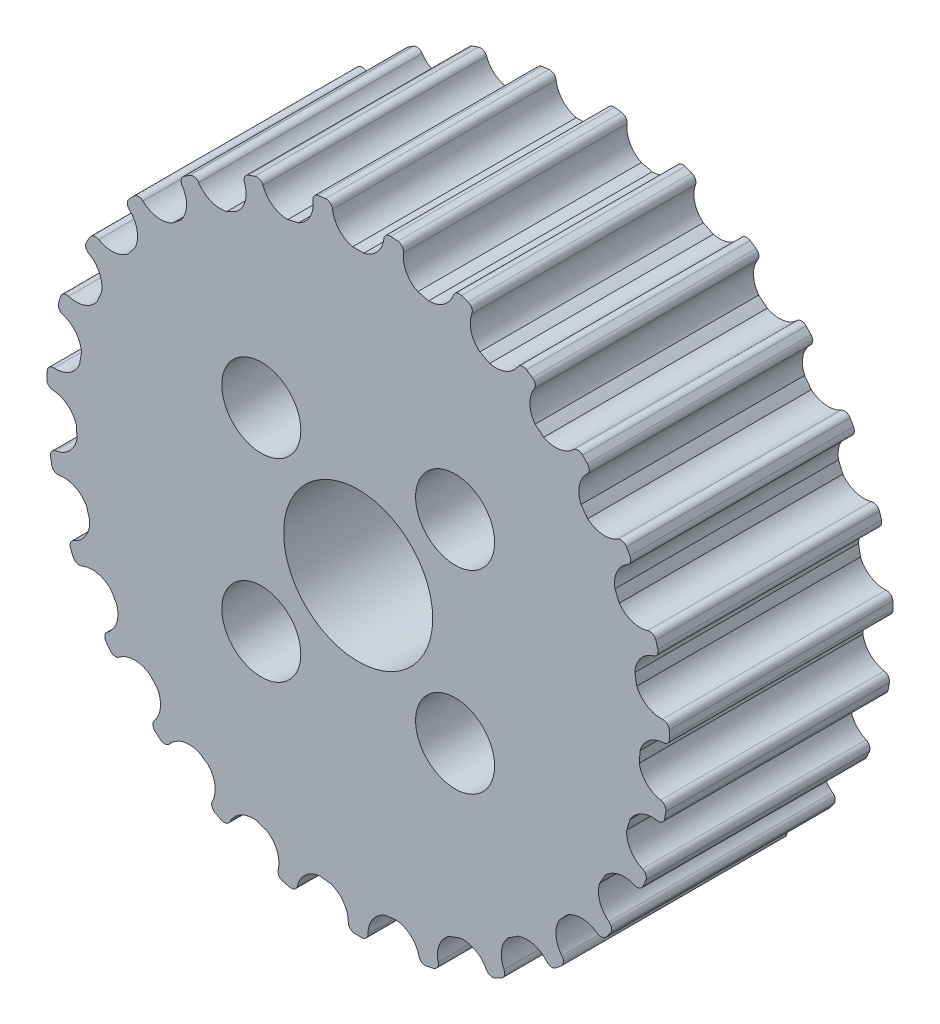
from build123d import *

# Parameters (mm, degrees)
BOSS_EXTRUDE1_DEPTH = 15
SKETCH2_R           = 2.65
SKETCH2_R_2         = 5
CUT_EXTRUDE1_DEPTH  = 34.149111671


with BuildPart() as part:
    # Sketch1 → Boss-Extrude1 (new body)
    with BuildSketch(Plane.XY.offset(7.5)):
        with BuildLine():
            ThreePointArc((-2.192674884, 20.798892855), (-2.427984889, 20.772738301), (-2.662983737, 20.743921634))
            ThreePointArc((-2.662983737, 20.743921634), (-2.947506786, 20.581604741), (-3.035143867, 20.265978568))
            ThreePointArc((-3.035143867, 20.265978568), (-3.233728916, 19.223961151), (-3.998220123, 18.488577228))
            ThreePointArc((-3.998220123, 18.488577228), (-4.362318815, 18.406070375), (-4.724718297, 18.316393998))
            ThreePointArc((-4.724718297, 18.316393998), (-5.737932295, 18.630454047), (-6.38305094, 19.472510015))
            ThreePointArc((-6.38305094, 19.472510015), (-6.603019063, 19.715232416), (-6.930125835, 19.732590379))
            ThreePointArc((-6.930125835, 19.732590379), (-7.153061373, 19.652874603), (-7.375080216, 19.570640229))
            ThreePointArc((-7.375080216, 19.570640229), (-7.614501058, 19.347083077), (-7.626987465, 19.019754147))
            ThreePointArc((-7.626987465, 19.019754147), (-7.579913875, 17.96002758), (-8.154206919, 17.068162221))
            ThreePointArc((-8.154206919, 17.068162221), (-8.489463893, 16.903912414), (-8.821414055, 16.733078203))
            ThreePointArc((-8.821414055, 16.733078203), (-9.87974397, 16.805009495), (-10.701664828, 17.475593137))
            ThreePointArc((-10.701664828, 17.475593137), (-10.97167932, 17.661044784), (-11.293971909, 17.602498848))
            ThreePointArc((-11.293971909, 17.602498848), (-11.492514467, 17.473519347), (-11.689584212, 17.342300543))
            ThreePointArc((-11.689584212, 17.342300543), (-11.870995606, 17.069555157), (-11.807658194, 16.748169857))
            ThreePointArc((-11.807658194, 16.748169857), (-11.517463714, 15.727864274), (-11.870598309, 14.72759817))
            ThreePointArc((-11.870598309, 14.72759817), (-12.158939775, 14.490460159), (-12.442545097, 14.247677831))
            ThreePointArc((-12.442545097, 14.247677831), (-13.48893609, 14.07360253), (-14.443349196, 14.53656251))
            ThreePointArc((-14.443349196, 14.53656251), (-14.748853505, 14.654745656), (-15.048957033, 14.523452047))
            ThreePointArc((-15.048957033, 14.523452047), (-15.212403132, 14.352162141), (-15.373899697, 14.179032945))
            ThreePointArc((-15.373899697, 14.179032945), (-15.487521709, 13.871803101), (-15.351775014, 13.573687395))
            ThreePointArc((-15.351775014, 13.573687395), (-14.834104103, 12.647807734), (-14.947042671, 11.593065491))
            ThreePointArc((-14.947042671, 11.593065491), (-15.172924067, 11.295823447), (-15.392895313, 10.994181459))
            ThreePointArc((-15.392895313, 10.994181459), (-16.370936174, 10.583484011), (-17.40638887, 10.813862035))
            ThreePointArc((-17.40638887, 10.813862035), (-17.73091318, 10.858405396), (-17.992648989, 10.661442188))
            ThreePointArc((-17.992648989, 10.661442188), (-18.112187205, 10.457076159), (-18.22940427, 10.251370012))
            ThreePointArc((-18.22940427, 10.251370012), (-18.269111508, 9.926218548), (-18.06827367, 9.667443932))
            ThreePointArc((-18.06827367, 9.667443932), (-17.351034101, 8.885904605), (-17.217688094, 7.833547649))
            ThreePointArc((-17.217688094, 7.833547649), (-17.368932095, 7.492225968), (-17.513410558, 7.147985919))
            ThreePointArc((-17.513410558, 7.147985919), (-18.370374851, 6.522807129), (-19.431045614, 6.508183458))
            ThreePointArc((-19.431045614, 6.508183458), (-19.757094736, 6.476685692), (-19.96635258, 6.22467122))
            ThreePointArc((-19.96635258, 6.22467122), (-20.035538579, 5.998246494), (-20.10215694, 5.771053068))
            ThreePointArc((-20.10215694, 5.771053068), (-20.065808777, 5.445508984), (-19.810707015, 5.240026065))
            ThreePointArc((-19.810707015, 5.240026065), (-18.932565359, 4.644960059), (-18.560123495, 3.651721227))
            ThreePointArc((-18.560123495, 3.651721227), (-18.628576498, 3.284720649), (-18.689773307, 2.916440608))
            ThreePointArc((-18.689773307, 2.916440608), (-19.379461865, 2.110484027), (-20.40816966, 1.851647027))
            ThreePointArc((-20.40816966, 1.851647027), (-20.718166201, 1.745806185), (-20.863664936, 1.452326616))
            ThreePointArc((-20.863664936, 1.452326616), (-20.878768882, 1.216049808), (-20.891197126, 0.979617159))
            ThreePointArc((-20.891197126, 0.979617159), (-20.7807531, 0.671230622), (-20.485140017, 0.530117036))
            ThreePointArc((-20.485140017, 0.530117036), (-19.493437118, 0.153604514), (-18.901977835, -0.726970433))
            ThreePointArc((-18.901977835, -0.726970433), (-18.88394952, -1.099864811), (-18.858565539, -1.472330771))
            ThreePointArc((-18.858565539, -1.472330771), (-19.343797074, -2.415615816), (-20.285083997, -2.904712175))
            ThreePointArc((-20.285083997, -2.904712175), (-20.562315963, -3.079190186), (-20.636211714, -3.398313292))
            ThreePointArc((-20.636211714, -3.398313292), (-20.59641935, -3.631704437), (-20.553987468, -3.864630165))
            ThreePointArc((-20.553987468, -3.864630165), (-20.375401645, -4.139233957), (-20.055213819, -4.20837074))
            ThreePointArc((-20.055213819, -4.20837074), (-19.003412636, -4.346031891), (-18.224821657, -5.066470928))
            ThreePointArc((-18.224821657, -5.066470928), (-18.121283936, -5.425156274), (-18.010687621, -5.781728417))
            ThreePointArc((-18.010687621, -5.781728417), (-18.265303176, -6.811489185), (-19.068424205, -7.504477591))
            ThreePointArc((-19.068424205, -7.504477591), (-19.297945949, -7.738186616), (-19.296254978, -8.065749251))
            ThreePointArc((-19.296254978, -8.065749251), (-19.20371152, -8.283672557), (-19.108707025, -8.500534276))
            ThreePointArc((-19.108707025, -8.500534276), (-18.871607014, -8.726551362), (-18.544105852, -8.71998416))
            ThreePointArc((-18.544105852, -8.71998416), (-17.48890926, -8.611372591), (-16.565160626, -9.132836663))
            ThreePointArc((-16.565160626, -9.132836663), (-16.381695244, -9.457976159), (-16.191848872, -9.779431588))
            ThreePointArc((-16.191848872, -9.779431588), (-16.202122055, -10.840153409), (-16.823780729, -11.699674678))
            ThreePointArc((-16.823780729, -11.699674678), (-16.993218674, -11.980015403), (-16.916032141, -12.29835858))
            ThreePointArc((-16.916032141, -12.29835858), (-16.775726631, -12.489065745), (-16.633271241, -12.678172384))
            ThreePointArc((-16.633271241, -12.678172384), (-16.350439163, -12.843418125), (-16.033280339, -12.761500976))
            ThreePointArc((-16.033280339, -12.761500976), (-15.03157426, -12.412471966), (-14.012467498, -12.706848811))
            ThreePointArc((-14.012467498, -12.706848811), (-13.758965121, -12.9809141), (-13.500103359, -13.24992307))
            ThreePointArc((-13.500103359, -13.24992307), (-13.265480341, -14.284422156), (-13.672162879, -15.264139275))
            ThreePointArc((-13.672162879, -15.264139275), (-13.772382582, -15.575998458), (-13.623861633, -15.867960214))
            ThreePointArc((-13.623861633, -15.867960214), (-13.443357977, -16.021170165), (-13.261131498, -16.172326937))
            ThreePointArc((-13.261131498, -16.172326937), (-12.947814905, -16.267892892), (-12.658096533, -16.115041972))
            ThreePointArc((-12.658096533, -16.115041972), (-11.7638832, -15.544411764), (-10.70435862, -15.59583145))
            ThreePointArc((-10.70435862, -15.59583145), (-10.394485627, -15.804047602), (-10.08056378, -16.00610777))
            ThreePointArc((-10.08056378, -16.00610777), (-9.613693148, -16.958614008), (-9.783475189, -18.005710173))
            ThreePointArc((-9.783475189, -18.005710173), (-9.80907378, -18.332275405), (-9.597225218, -18.582116006))
            ThreePointArc((-9.597225218, -18.582116006), (-9.386254415, -18.689569156), (-9.174080724, -18.794627158))
            ThreePointArc((-9.174080724, -18.794627158), (-8.847170594, -18.815361342), (-8.600511466, -18.599816884))
            ThreePointArc((-8.600511466, -18.599816884), (-7.861998151, -17.8383483), (-6.819174998, -17.644038779))
            ThreePointArc((-6.819174998, -17.644038779), (-6.469636723, -17.775180808), (-6.117578398, -17.899399058))
            ThreePointArc((-6.117578398, -17.899399058), (-5.443629269, -18.718562589), (-5.367357819, -19.776588574))
            ThreePointArc((-5.367357819, -19.776588574), (-5.316955271, -20.10025464), (-5.053199907, -20.294505115))
            ThreePointArc((-5.053199907, -20.294505115), (-4.823135448, -20.350408635), (-4.592452883, -20.403704165))
            ThreePointArc((-4.592452883, -20.403704165), (-4.269573027, -20.348488792), (-4.0792706, -20.081870853))
            ThreePointArc((-4.0792706, -20.081870853), (-3.536270748, -19.170614863), (-2.566367887, -18.74105141))
            ThreePointArc((-2.566367887, -18.74105141), (-2.196008028, -18.788049415), (-1.824792781, -18.827729108))
            ThreePointArc((-1.824792781, -18.827729108), (-0.980097927, -19.469388616), (-0.6618848, -20.481305967))
            ThreePointArc((-0.6618848, -20.481305967), (-0.538198328, -20.784623945), (-0.236755281, -20.9128122))
            ThreePointArc((-0.236755281, -20.9128122), (0, -20.914152317), (0.236755281, -20.9128122))
            ThreePointArc((0.236755281, -20.9128122), (0.538198328, -20.784623945), (0.6618848, -20.481305967))
            ThreePointArc((0.6618848, -20.481305967), (0.980097927, -19.469388616), (1.824792781, -18.827729108))
            ThreePointArc((1.824792781, -18.827729108), (2.196008028, -18.788049415), (2.566367887, -18.74105141))
            ThreePointArc((2.566367887, -18.74105141), (3.536270748, -19.170614863), (4.0792706, -20.081870853))
            ThreePointArc((4.0792706, -20.081870853), (4.269573027, -20.348488792), (4.592452883, -20.403704165))
            ThreePointArc((4.592452883, -20.403704165), (4.823135448, -20.350408635), (5.053199907, -20.294505115))
            ThreePointArc((5.053199907, -20.294505115), (5.316955271, -20.10025464), (5.367357819, -19.776588574))
            ThreePointArc((5.367357819, -19.776588574), (5.443629269, -18.718562589), (6.117578398, -17.899399058))
            ThreePointArc((6.117578398, -17.899399058), (6.469636723, -17.775180808), (6.819174998, -17.644038779))
            ThreePointArc((6.819174998, -17.644038779), (7.861998151, -17.8383483), (8.600511466, -18.599816884))
            ThreePointArc((8.600511466, -18.599816884), (8.847170594, -18.815361342), (9.174080724, -18.794627158))
            ThreePointArc((9.174080724, -18.794627158), (9.386254415, -18.689569156), (9.597225218, -18.582116006))
            ThreePointArc((9.597225218, -18.582116006), (9.80907378, -18.332275405), (9.783475189, -18.005710173))
            ThreePointArc((9.783475189, -18.005710173), (9.613693148, -16.958614008), (10.08056378, -16.00610777))
            ThreePointArc((10.08056378, -16.00610777), (10.394485627, -15.804047602), (10.70435862, -15.59583145))
            ThreePointArc((10.70435862, -15.59583145), (11.7638832, -15.544411764), (12.658096533, -16.115041972))
            ThreePointArc((12.658096533, -16.115041972), (12.947814905, -16.267892892), (13.261131498, -16.172326937))
            ThreePointArc((13.261131498, -16.172326937), (13.443357977, -16.021170165), (13.623861633, -15.867960214))
            ThreePointArc((13.623861633, -15.867960214), (13.772382582, -15.575998458), (13.672162879, -15.264139275))
            ThreePointArc((13.672162879, -15.264139275), (13.265480341, -14.284422156), (13.500103359, -13.24992307))
            ThreePointArc((13.500103359, -13.24992307), (13.758965121, -12.9809141), (14.012467498, -12.706848811))
            ThreePointArc((14.012467498, -12.706848811), (15.03157426, -12.412471966), (16.033280339, -12.761500976))
            ThreePointArc((16.033280339, -12.761500976), (16.350439163, -12.843418125), (16.633271241, -12.678172384))
            ThreePointArc((16.633271241, -12.678172384), (16.775726631, -12.489065745), (16.916032141, -12.29835858))
            ThreePointArc((16.916032141, -12.29835858), (16.993218674, -11.980015403), (16.823780729, -11.699674678))
            ThreePointArc((16.823780729, -11.699674678), (16.202122055, -10.840153409), (16.191848872, -9.779431588))
            ThreePointArc((16.191848872, -9.779431588), (16.381695244, -9.457976159), (16.565160626, -9.132836663))
            ThreePointArc((16.565160626, -9.132836663), (17.48890926, -8.611372591), (18.544105852, -8.71998416))
            ThreePointArc((18.544105852, -8.71998416), (18.871607014, -8.726551362), (19.108707025, -8.500534276))
            ThreePointArc((19.108707025, -8.500534276), (19.20371152, -8.283672557), (19.296254978, -8.065749251))
            ThreePointArc((19.296254978, -8.065749251), (19.297945949, -7.738186616), (19.068424205, -7.504477591))
            ThreePointArc((19.068424205, -7.504477591), (18.265303176, -6.811489185), (18.010687621, -5.781728417))
            ThreePointArc((18.010687621, -5.781728417), (18.121283936, -5.425156274), (18.224821657, -5.066470928))
            ThreePointArc((18.224821657, -5.066470928), (19.003412636, -4.346031891), (20.055213819, -4.20837074))
            ThreePointArc((20.055213819, -4.20837074), (20.375401645, -4.139233957), (20.553987468, -3.864630165))
            ThreePointArc((20.553987468, -3.864630165), (20.59641935, -3.631704437), (20.636211714, -3.398313292))
            ThreePointArc((20.636211714, -3.398313292), (20.562315963, -3.079190186), (20.285083997, -2.904712175))
            ThreePointArc((20.285083997, -2.904712175), (19.343797074, -2.415615816), (18.858565539, -1.472330771))
            ThreePointArc((18.858565539, -1.472330771), (18.88394952, -1.099864811), (18.901977835, -0.726970433))
            ThreePointArc((18.901977835, -0.726970433), (19.493437118, 0.153604514), (20.485140017, 0.530117036))
            ThreePointArc((20.485140017, 0.530117036), (20.7807531, 0.671230622), (20.891197126, 0.979617159))
            ThreePointArc((20.891197126, 0.979617159), (20.878768882, 1.216049808), (20.863664936, 1.452326616))
            ThreePointArc((20.863664936, 1.452326616), (20.718166201, 1.745806185), (20.40816966, 1.851647027))
            ThreePointArc((20.40816966, 1.851647027), (19.379461865, 2.110484027), (18.689773307, 2.916440608))
            ThreePointArc((18.689773307, 2.916440608), (18.628576498, 3.284720649), (18.560123495, 3.651721227))
            ThreePointArc((18.560123495, 3.651721227), (18.932565359, 4.644960059), (19.810707015, 5.240026065))
            ThreePointArc((19.810707015, 5.240026065), (20.065808777, 5.445508984), (20.10215694, 5.771053068))
            ThreePointArc((20.10215694, 5.771053068), (20.035538579, 5.998246494), (19.96635258, 6.22467122))
            ThreePointArc((19.96635258, 6.22467122), (19.757094736, 6.476685692), (19.431045614, 6.508183458))
            ThreePointArc((19.431045614, 6.508183458), (18.370374851, 6.522807129), (17.513410558, 7.147985919))
            ThreePointArc((17.513410558, 7.147985919), (17.368932095, 7.492225968), (17.217688094, 7.833547649))
            ThreePointArc((17.217688094, 7.833547649), (17.351034101, 8.885904605), (18.06827367, 9.667443932))
            ThreePointArc((18.06827367, 9.667443932), (18.269111508, 9.926218548), (18.22940427, 10.251370012))
            ThreePointArc((18.22940427, 10.251370012), (18.112187205, 10.457076159), (17.992648989, 10.661442188))
            ThreePointArc((17.992648989, 10.661442188), (17.73091318, 10.858405396), (17.40638887, 10.813862035))
            ThreePointArc((17.40638887, 10.813862035), (16.370936174, 10.583484011), (15.392895313, 10.994181459))
            ThreePointArc((15.392895313, 10.994181459), (15.172924067, 11.295823447), (14.947042671, 11.593065491))
            ThreePointArc((14.947042671, 11.593065491), (14.834104103, 12.647807734), (15.351775014, 13.573687395))
            ThreePointArc((15.351775014, 13.573687395), (15.487521709, 13.871803101), (15.373899697, 14.179032945))
            ThreePointArc((15.373899697, 14.179032945), (15.212403132, 14.352162141), (15.048957033, 14.523452047))
            ThreePointArc((15.048957033, 14.523452047), (14.748853505, 14.654745656), (14.443349196, 14.53656251))
            ThreePointArc((14.443349196, 14.53656251), (13.48893609, 14.07360253), (12.442545097, 14.247677831))
            ThreePointArc((12.442545097, 14.247677831), (12.158939775, 14.490460159), (11.870598309, 14.72759817))
            ThreePointArc((11.870598309, 14.72759817), (11.517463714, 15.727864274), (11.807658194, 16.748169857))
            ThreePointArc((11.807658194, 16.748169857), (11.870995606, 17.069555157), (11.689584212, 17.342300543))
            ThreePointArc((11.689584212, 17.342300543), (11.492514467, 17.473519347), (11.293971909, 17.602498848))
            ThreePointArc((11.293971909, 17.602498848), (10.97167932, 17.661044784), (10.701664828, 17.475593137))
            ThreePointArc((10.701664828, 17.475593137), (9.87974397, 16.805009495), (8.821414055, 16.733078203))
            ThreePointArc((8.821414055, 16.733078203), (8.489463893, 16.903912414), (8.154206919, 17.068162221))
            ThreePointArc((8.154206919, 17.068162221), (7.579913875, 17.96002758), (7.626987465, 19.019754147))
            ThreePointArc((7.626987465, 19.019754147), (7.614501058, 19.347083077), (7.375080216, 19.570640229))
            ThreePointArc((7.375080216, 19.570640229), (7.153061373, 19.652874603), (6.930125835, 19.732590379))
            ThreePointArc((6.930125835, 19.732590379), (6.603019063, 19.715232416), (6.38305094, 19.472510015))
            ThreePointArc((6.38305094, 19.472510015), (5.737932295, 18.630454047), (4.724718297, 18.316393998))
            ThreePointArc((4.724718297, 18.316393998), (4.362318815, 18.406070375), (3.998220123, 18.488577228))
            ThreePointArc((3.998220123, 18.488577228), (3.233728916, 19.223961151), (3.035143867, 20.265978568))
            ThreePointArc((3.035143867, 20.265978568), (2.947506786, 20.581604741), (2.662983737, 20.743921634))
            ThreePointArc((2.662983737, 20.743921634), (2.427984889, 20.772738301), (2.192674884, 20.798892855))
            ThreePointArc((2.192674884, 20.798892855), (1.878388339, 20.706566765), (1.720325123, 20.419658838))
            ThreePointArc((1.720325123, 20.419658838), (1.286787205, 19.451525999), (0.373311754, 18.912268251))
            ThreePointArc((0.373311754, 18.912268251), (0, 18.915952317), (-0.373311754, 18.912268251))
            ThreePointArc((-0.373311754, 18.912268251), (-1.286787205, 19.451525999), (-1.720325123, 20.419658838))
            ThreePointArc((-1.720325123, 20.419658838), (-1.878388339, 20.706566765), (-2.192674884, 20.798892855))
        make_face()
    extrude(amount=-BOSS_EXTRUDE1_DEPTH)

    # Sketch2 → Cut-Extrude1 (cut, through all)
    with BuildSketch(Plane.XY.offset(7.5)):
        with Locations((-6.5, 6.5)):
            Circle(SKETCH2_R)
        with Locations((6.5, 6.5)):
            Circle(SKETCH2_R)
        with Locations((6.5, -6.5)):
            Circle(SKETCH2_R)
        with Locations((-6.5, -6.5)):
            Circle(SKETCH2_R)
        Circle(SKETCH2_R_2)
    extrude(amount=-CUT_EXTRUDE1_DEPTH, mode=Mode.SUBTRACT)


solid = part.part
